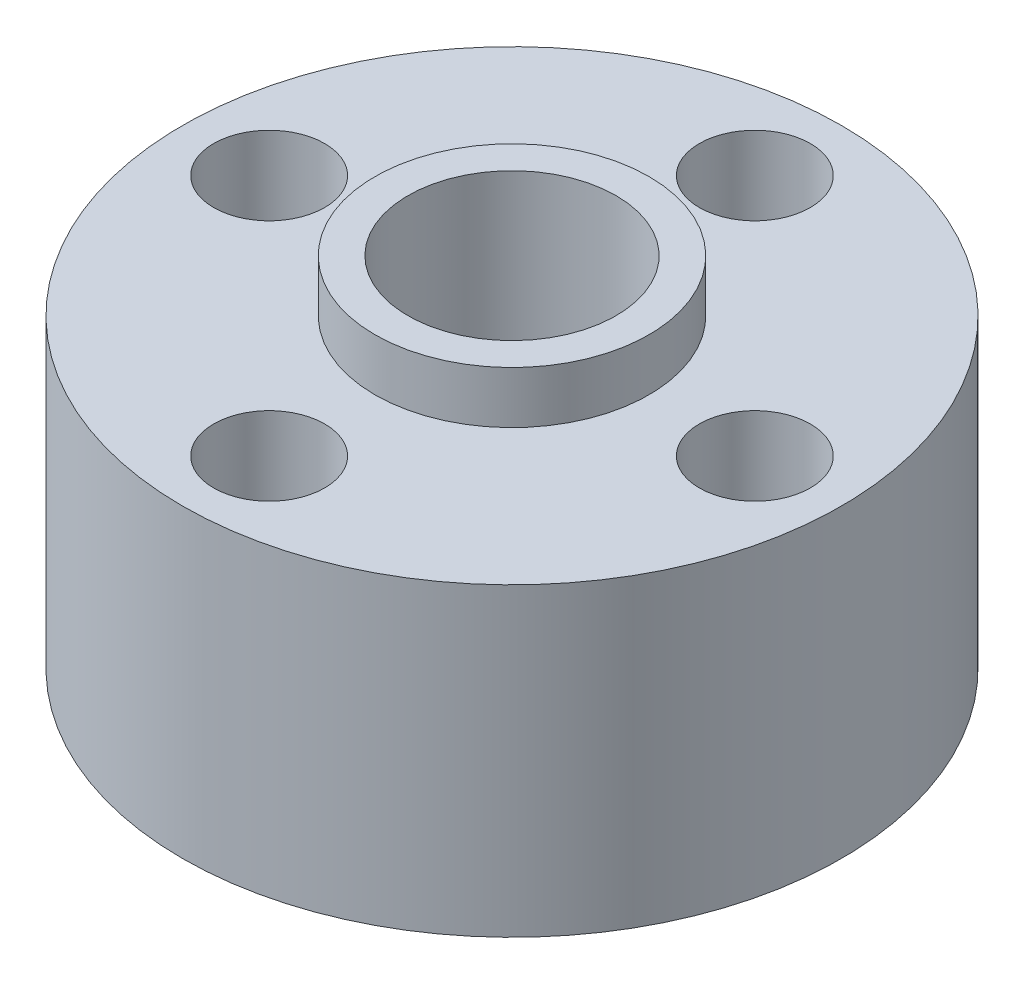
from build123d import *

# Parameters (mm, degrees)
SKETCH_1_W                  = 9.5
SKETCH_1_H                  = 8.8
SKETCH_2_R                  = 3.95
EXTRUDE_1_DEPTH             = 1.5
EXTRUDE_START               = 1.5
SKETCH_3_R                  = 3.95
EXTRUDE_2_DEPTH             = 1.5
HOLE_WIZARD_3_2_3_2_1_D     = 3.2
HOLE_WIZARD_3_2_3_2_1_DEPTH = 10.3
HOLE_WIZARD_6_0_6_1_D       = 6


with BuildPart() as part:
    # 草图1 → 旋转1 (revolve)
    with BuildSketch(Plane(origin=(0, 0, 0), x_dir=(-1, 0, 0), z_dir=(0, 0, -1)), mode=Mode.PRIVATE) as revolve_1_sk:
        with Locations((-4.75, 0.025)):
            Rectangle(SKETCH_1_W, SKETCH_1_H)
    revolve(revolve_1_sk.sketch.rotate(Axis((0, -4.375, 0), (0, 1, 0)), 270), axis=Axis((0, -4.375, 0), (0, 1, 0)))

    # 草图2 → 凸台-拉伸1 (add)
    with BuildSketch(Plane(origin=(0, 4.425, 0), x_dir=(-1, 0, 0), z_dir=(0, 1, 0))):
        with Locations(Location((0, 0, 0), (0, 0, 90))):
            Circle(SKETCH_2_R)
    extrude(amount=EXTRUDE_1_DEPTH)

    # 草图3 → 凸台-拉伸2 (add)
    with BuildSketch(Plane.XZ.offset(4.375).offset(EXTRUDE_START)):
        with Locations(Location((0, 0, 0), (0, 0, 90))):
            Circle(SKETCH_3_R)
    extrude(amount=-EXTRUDE_2_DEPTH)

    # Ø3.2 (3.2) 直径孔1
    with Locations(Plane(origin=(0, -4.375, 0), x_dir=(-1, 0, 0), z_dir=(0, -1, 0))):
        with Locations((0, 7), (-7, 0), (0, -7), (7, 0)):
            Hole(HOLE_WIZARD_3_2_3_2_1_D / 2, depth=HOLE_WIZARD_3_2_3_2_1_DEPTH)

    # Ø6.0 (6) 直径孔1 (through all)
    with Locations(Plane(origin=(0, -5.875, 0), x_dir=(-1, 0, 0), z_dir=(0, -1, 0))):
        with Locations((0, 0)):
            Hole(HOLE_WIZARD_6_0_6_1_D / 2)


solid = part.part
